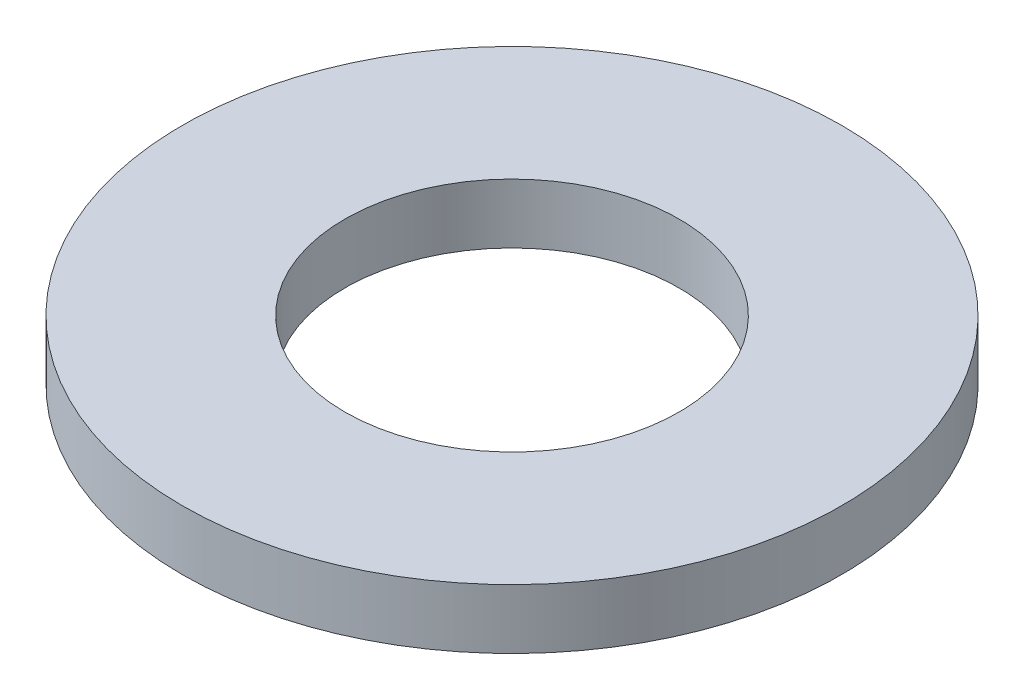
from build123d import *

# Parameters (mm, degrees)
SKETCH1_R      = 8.763
SKETCH1_R_2    = 4.445
EXTRUDE1_DEPTH = 1.5875


with BuildPart() as part:
    # Sketch1 → Extrude1 (new body)
    with BuildSketch(Plane(origin=(0, 0, 0), x_dir=(1, 0, 0), z_dir=(0, 1, 0))):
        with Locations(Location((0, 0, 0), (0, 0, 270))):
            Circle(SKETCH1_R)
        with Locations(Location((0, 0, 0), (0, 0, 270))):
            Circle(SKETCH1_R_2, mode=Mode.SUBTRACT)
    extrude(amount=EXTRUDE1_DEPTH)


solid = part.part
